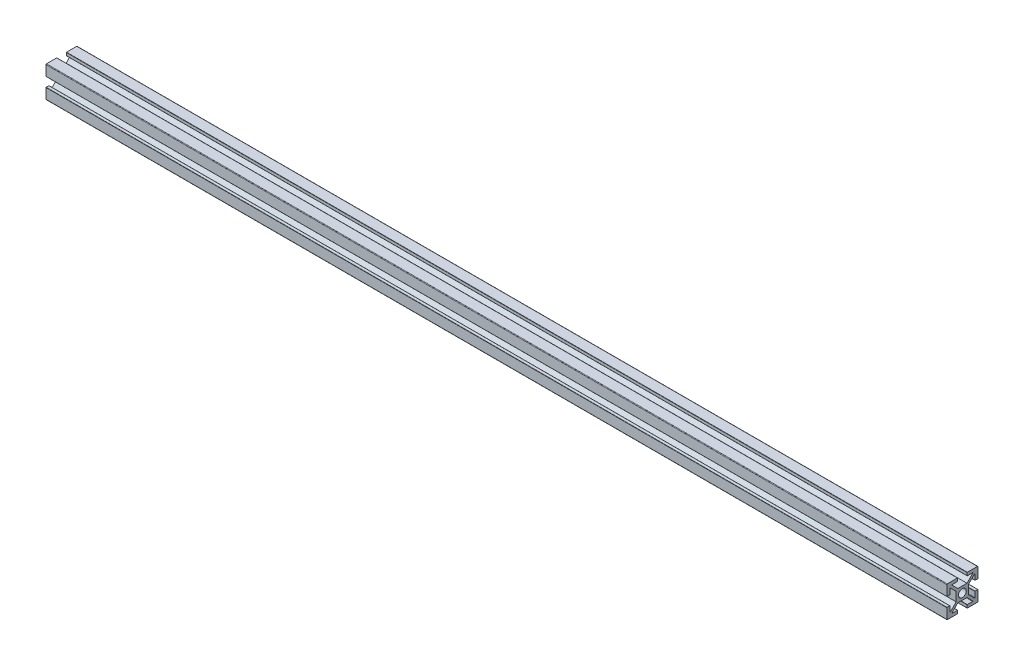
from build123d import *

# Parameters (mm, degrees)
SKETCH1_R           = 2.5
BOSS_EXTRUDE1_DEPTH = 580
SKETCH7_R           = 2
CUT_EXTRUDE1_DEPTH  = 3


with BuildPart() as part:
    # Sketch1 → Boss-Extrude1 (new body)
    with BuildSketch(Plane(origin=(0, 0, 0), x_dir=(0, 0, -1), z_dir=(1, 0, 0))):
        with BuildLine():
            Line((-27.532734066, 12.651868009), (-25.832734066, 12.651868009))
            ThreePointArc((-25.832734066, 12.651868009), (-25.726668049, 12.695801992), (-25.682734066, 12.801868009))
            Line((-25.682734066, 12.801868009), (-25.682734066, 16.238052523))
            ThreePointArc((-25.682734066, 16.238052523), (-25.590535021, 16.376468742), (-25.427280071, 16.34472705))
            Line((-25.427280071, 16.34472705), (-21.63643777, 12.597258231))
            Line((-21.63643777, 12.597258231), (-21.63643777, 6.706477787))
            Line((-21.63643777, 6.706477787), (-25.427280071, 2.959008968))
            ThreePointArc((-25.427280071, 2.959008968), (-25.590535021, 2.927267277), (-25.682734066, 3.065683496))
            Line((-25.682734066, 3.065683496), (-25.682734066, 6.501868009))
            ThreePointArc((-25.682734066, 6.501868009), (-25.726668049, 6.607934026), (-25.832734066, 6.651868009))
            Line((-25.832734066, 6.651868009), (-27.532734066, 6.651868009))
            ThreePointArc((-27.532734066, 6.651868009), (-27.638800084, 6.607934026), (-27.682734066, 6.501868009))
            Line((-27.682734066, 6.501868009), (-27.682734066, 0.001868009))
            ThreePointArc((-27.682734066, 0.001868009), (-27.58022144, -0.245619364), (-27.332734066, -0.348131991))
            Line((-27.332734066, -0.348131991), (-20.832734066, -0.348131991))
            ThreePointArc((-20.832734066, -0.348131991), (-20.726668049, -0.304198008), (-20.682734066, -0.198131991))
            Line((-20.682734066, -0.198131991), (-20.682734066, 1.501868009))
            ThreePointArc((-20.682734066, 1.501868009), (-20.726668049, 1.607934026), (-20.832734066, 1.651868009))
            Line((-20.832734066, 1.651868009), (-24.250818864, 1.651868009))
            ThreePointArc((-24.250818864, 1.651868009), (-24.389565357, 1.744864409), (-24.356272859, 1.908542537))
            Line((-24.356272859, 1.908542537), (-20.56962186, 5.651868009))
            Line((-20.56962186, 5.651868009), (-14.70325368, 5.651868009))
            Line((-14.70325368, 5.651868009), (-10.916602681, 1.908542537))
            ThreePointArc((-10.916602681, 1.908542537), (-10.883310183, 1.744864409), (-11.022056677, 1.651868009))
            Line((-11.022056677, 1.651868009), (-14.440141474, 1.651868009))
            ThreePointArc((-14.440141474, 1.651868009), (-14.546207491, 1.607934026), (-14.590141474, 1.501868009))
            Line((-14.590141474, 1.501868009), (-14.590141474, -0.198131991))
            ThreePointArc((-14.590141474, -0.198131991), (-14.546207491, -0.304198008), (-14.440141474, -0.348131991))
            Line((-14.440141474, -0.348131991), (-7.940141474, -0.348131991))
            ThreePointArc((-7.940141474, -0.348131991), (-7.6926541, -0.245619364), (-7.590141474, 0.001868009))
            Line((-7.590141474, 0.001868009), (-7.590141474, 6.501868009))
            ThreePointArc((-7.590141474, 6.501868009), (-7.634075457, 6.607934026), (-7.740141474, 6.651868009))
            Line((-7.740141474, 6.651868009), (-9.440141474, 6.651868009))
            ThreePointArc((-9.440141474, 6.651868009), (-9.546207491, 6.607934026), (-9.590141474, 6.501868009))
            Line((-9.590141474, 6.501868009), (-9.590141474, 3.065683496))
            ThreePointArc((-9.590141474, 3.065683496), (-9.682340519, 2.927267277), (-9.845595469, 2.959008968))
            Line((-9.845595469, 2.959008968), (-13.63643777, 6.706477787))
            Line((-13.63643777, 6.706477787), (-13.63643777, 12.597258231))
            Line((-13.63643777, 12.597258231), (-9.845595469, 16.34472705))
            ThreePointArc((-9.845595469, 16.34472705), (-9.682340519, 16.376468742), (-9.590141474, 16.238052523))
            Line((-9.590141474, 16.238052523), (-9.590141474, 12.801868009))
            ThreePointArc((-9.590141474, 12.801868009), (-9.546207491, 12.695801992), (-9.440141474, 12.651868009))
            Line((-9.440141474, 12.651868009), (-7.740141474, 12.651868009))
            ThreePointArc((-7.740141474, 12.651868009), (-7.634075457, 12.695801992), (-7.590141474, 12.801868009))
            Line((-7.590141474, 12.801868009), (-7.590141474, 19.301868009))
            ThreePointArc((-7.590141474, 19.301868009), (-7.6926541, 19.549355383), (-7.940141474, 19.651868009))
            Line((-7.940141474, 19.651868009), (-14.440141474, 19.651868009))
            ThreePointArc((-14.440141474, 19.651868009), (-14.546207491, 19.607934026), (-14.590141474, 19.501868009))
            Line((-14.590141474, 19.501868009), (-14.590141474, 17.801868009))
            ThreePointArc((-14.590141474, 17.801868009), (-14.546207491, 17.695801992), (-14.440141474, 17.651868009))
            Line((-14.440141474, 17.651868009), (-11.022056677, 17.651868009))
            ThreePointArc((-11.022056677, 17.651868009), (-10.883310183, 17.558871609), (-10.916602681, 17.395193482))
            Line((-10.916602681, 17.395193482), (-14.70325368, 13.651868009))
            Line((-14.70325368, 13.651868009), (-20.56962186, 13.651868009))
            Line((-20.56962186, 13.651868009), (-24.356272859, 17.395193482))
            ThreePointArc((-24.356272859, 17.395193482), (-24.389565357, 17.558871609), (-24.250818864, 17.651868009))
            Line((-24.250818864, 17.651868009), (-20.832734066, 17.651868009))
            ThreePointArc((-20.832734066, 17.651868009), (-20.726668049, 17.695801992), (-20.682734066, 17.801868009))
            Line((-20.682734066, 17.801868009), (-20.682734066, 19.501868009))
            ThreePointArc((-20.682734066, 19.501868009), (-20.726668049, 19.607934026), (-20.832734066, 19.651868009))
            Line((-20.832734066, 19.651868009), (-27.332734066, 19.651868009))
            ThreePointArc((-27.332734066, 19.651868009), (-27.58022144, 19.549355383), (-27.682734066, 19.301868009))
            Line((-27.682734066, 19.301868009), (-27.682734066, 12.801868009))
            ThreePointArc((-27.682734066, 12.801868009), (-27.638800084, 12.695801992), (-27.532734066, 12.651868009))
        make_face()
        with Locations((-17.63643777, 9.651868009)):
            Circle(SKETCH1_R, mode=Mode.SUBTRACT)
    extrude(amount=BOSS_EXTRUDE1_DEPTH)

    # Sketch7 → Cut-Extrude1 (cut)
    with BuildSketch(Plane(origin=(0, 13.651868009, 0), x_dir=(1, 0, 0), z_dir=(0, 1, 0))):
        with Locations(Location((20, -17.63643777, 0), (0, 0, 270))):
            Circle(SKETCH7_R)
        with Locations(Location((458, -17.63643777, 0), (0, 0, 270))):
            Circle(SKETCH7_R)
        with Locations(Location((518, -17.63643777, 0), (0, 0, 270))):
            Circle(SKETCH7_R)
        with Locations(Location((560, -17.63643777, 0), (0, 0, 270))):
            Circle(SKETCH7_R)
        with Locations(Location((62, -17.63643777, 0), (0, 0, 270))):
            Circle(SKETCH7_R)
        with Locations(Location((122, -17.63643777, 0), (0, 0, 270))):
            Circle(SKETCH7_R)
        with Locations(Location((165, -17.63643777, 0), (0, 0, 270))):
            Circle(SKETCH7_R)
        with Locations(Location((290, -17.63643777, 0), (0, 0, 270))):
            Circle(SKETCH7_R)
        with Locations(Location((415, -17.63643777, 0), (0, 0, 270))):
            Circle(SKETCH7_R)
    extrude(amount=-CUT_EXTRUDE1_DEPTH, mode=Mode.SUBTRACT)


solid = part.part
